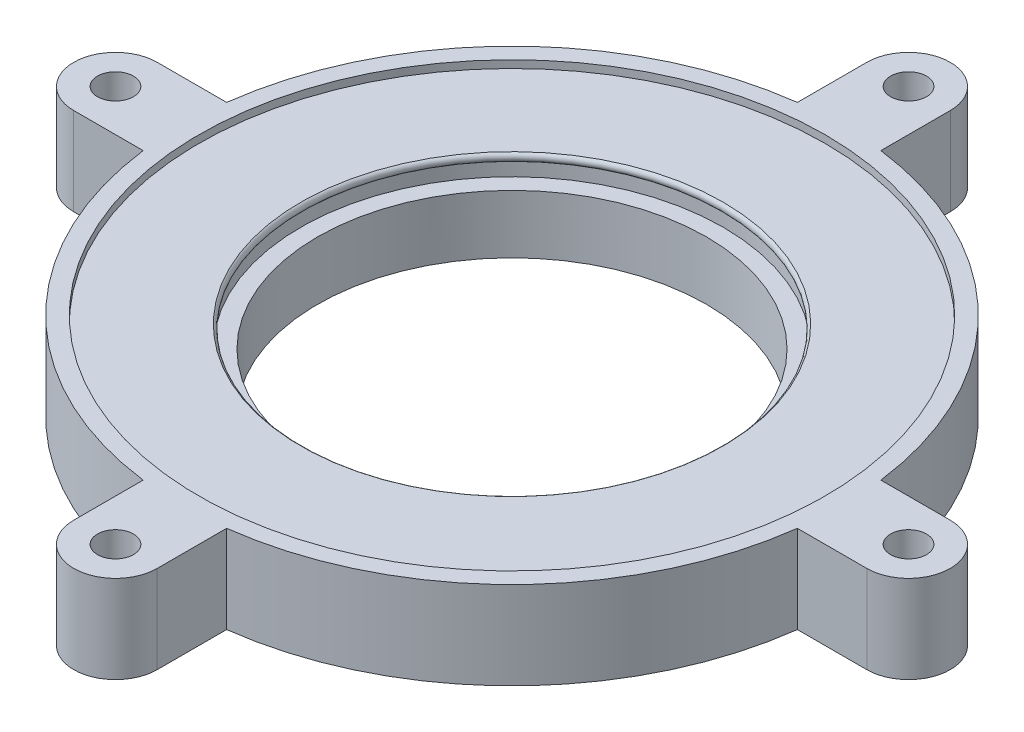
from build123d import *

# Parameters (mm, degrees)
SKETCH2_R           = 2.15
BOSS_EXTRUDE1_DEPTH = 10.507214
CUT_EXTRUDE2_DEPTH  = 7
SKETCH4_R           = 2.15
CUT_EXTRUDE3_DEPTH  = 7
BOSS_EXTRUDE2_START = -7
SKETCH5_R           = 24.3
SKETCH5_R_2         = 23.3
BOSS_EXTRUDE2_DEPTH = 7
SKETCH6_R           = 23.3
CUT_EXTRUDE4_DEPTH  = 75.575465


with BuildPart() as part:
    # Sketch1 → Revolve1 (revolve)
    with BuildSketch(Plane(origin=(0, 0, 0), x_dir=(0, 0, -1), z_dir=(1, 0, 0)), mode=Mode.PRIVATE) as revolve1_sk:
        with BuildLine():
            Line((-37.5, -1.048229), (-37.5, -1.955443))
            Line((-37.5, -1.955443), (-25.3, -1.955443))
            ThreePointArc((-25.3, -1.955443), (-25, -2.455443), (-25.3, -2.955443))
            Line((-25.3, -2.955443), (-25.3, -4.555443))
            Line((-25.3, -4.555443), (-8, -4.555443))
            Line((-8, -4.555443), (-8, -11.555443))
            Line((-8, -11.555443), (-39.5, -11.555443))
            Line((-39.5, -11.555443), (-39.5, -1.048229))
            Line((-39.5, -1.048229), (-37.5, -1.048229))
        make_face()
    revolve(revolve1_sk.sketch.rotate(Axis((0, -1000, 0), (0, 1, 0)), 180), axis=Axis((0, -1000, 0), (0, 1, 0)))

    # Sketch2 → Boss-Extrude1 (add)
    # profile 1 of 4: a face of its own
    with BuildSketch(Plane.XZ.offset(11.555443)):
        with BuildLine():
            Line((-5, 47.5), (-5, 39.182266))
            Line((-5, 39.182266), (5, 39.182266))
            Line((5, 39.182266), (5, 47.5))
            ThreePointArc((5, 47.5), (0, 52.5), (-5, 47.5))
        make_face()
        with Locations(Location((0, 47.5, 0), (0, 0, 270))):
            Circle(SKETCH2_R, mode=Mode.SUBTRACT)
    # profile 2 of 4: a face of its own
    with BuildSketch(Plane.XZ.offset(11.555443)):
        with BuildLine():
            Line((47.5, -5), (39.182266, -5))
            Line((39.182266, -5), (39.182266, 5))
            Line((39.182266, 5), (47.5, 5))
            ThreePointArc((47.5, 5), (52.5, 0), (47.5, -5))
        make_face()
        with Locations(Location((47.5, 0, 0), (0, 0, 270))):
            Circle(SKETCH2_R, mode=Mode.SUBTRACT)
    # profile 3 of 4: a face of its own
    with BuildSketch(Plane.XZ.offset(11.555443)):
        with BuildLine():
            Line((-5, -47.5), (-5, -39.182266))
            Line((-5, -39.182266), (5, -39.182266))
            Line((5, -39.182266), (5, -47.5))
            ThreePointArc((5, -47.5), (0, -52.5), (-5, -47.5))
        make_face()
        with Locations(Location((0, -47.5, 0), (0, 0, 270))):
            Circle(SKETCH2_R, mode=Mode.SUBTRACT)
    # profile 4 of 4: a face of its own
    with BuildSketch(Plane.XZ.offset(11.555443)):
        with BuildLine():
            Line((-47.5, 5), (-39.182266, 5))
            Line((-39.182266, 5), (-39.182266, -5))
            Line((-39.182266, -5), (-47.5, -5))
            ThreePointArc((-47.5, -5), (-52.5, 0), (-47.5, 5))
        make_face()
        with Locations(Location((-47.5, 0, 0), (0, 0, 270))):
            Circle(SKETCH2_R, mode=Mode.SUBTRACT)
    extrude(amount=-BOSS_EXTRUDE1_DEPTH)

    # Sketch3 → Cut-Extrude2 (cut)
    with BuildSketch(Plane(origin=(0, -4.555443, 0), x_dir=(1, 0, 0), z_dir=(0, 1, 0))):
        with BuildLine():
            Line((21.938323, -2), (12.369317, -2))
            ThreePointArc((12.369317, -2), (11.19262, -2.382785), (10.466345, -3.384615))
            ThreePointArc((10.466345, -3.384615), (7.778175, -7.778175), (3.384615, -10.466345))
            ThreePointArc((3.384615, -10.466345), (2.382785, -11.19262), (2, -12.369317))
            Line((2, -12.369317), (2, -21.938323))
            ThreePointArc((2, -21.938323), (2.718885, -23.474143), (4.358744, -23.905885))
            ThreePointArc((4.358744, -23.905885), (17.182695, -17.182695), (23.905885, -4.358744))
            ThreePointArc((23.905885, -4.358744), (23.474143, -2.718885), (21.938323, -2))
        make_face()
        with BuildLine():
            Line((-2, -21.938323), (-2, -12.369317))
            ThreePointArc((-2, -12.369317), (-2.382785, -11.19262), (-3.384615, -10.466345))
            ThreePointArc((-3.384615, -10.466345), (-7.778175, -7.778175), (-10.466345, -3.384615))
            ThreePointArc((-10.466345, -3.384615), (-11.19262, -2.382785), (-12.369317, -2))
            Line((-12.369317, -2), (-21.938323, -2))
            ThreePointArc((-21.938323, -2), (-23.474143, -2.718885), (-23.905885, -4.358744))
            ThreePointArc((-23.905885, -4.358744), (-17.182695, -17.182695), (-4.358744, -23.905885))
            ThreePointArc((-4.358744, -23.905885), (-2.718885, -23.474143), (-2, -21.938323))
        make_face()
        with BuildLine():
            Line((-21.938323, 2), (-12.369317, 2))
            ThreePointArc((-12.369317, 2), (-11.19262, 2.382785), (-10.466345, 3.384615))
            ThreePointArc((-10.466345, 3.384615), (-7.778175, 7.778175), (-3.384615, 10.466345))
            ThreePointArc((-3.384615, 10.466345), (-2.382785, 11.19262), (-2, 12.369317))
            Line((-2, 12.369317), (-2, 21.938323))
            ThreePointArc((-2, 21.938323), (-2.718885, 23.474143), (-4.358744, 23.905885))
            ThreePointArc((-4.358744, 23.905885), (-17.182695, 17.182695), (-23.905885, 4.358744))
            ThreePointArc((-23.905885, 4.358744), (-23.474143, 2.718885), (-21.938323, 2))
        make_face()
        with BuildLine():
            Line((2, 21.938323), (2, 12.369317))
            ThreePointArc((2, 12.369317), (2.382785, 11.19262), (3.384615, 10.466345))
            ThreePointArc((3.384615, 10.466345), (7.778175, 7.778175), (10.466345, 3.384615))
            ThreePointArc((10.466345, 3.384615), (11.19262, 2.382785), (12.369317, 2))
            Line((12.369317, 2), (21.938323, 2))
            ThreePointArc((21.938323, 2), (23.474143, 2.718885), (23.905885, 4.358744))
            ThreePointArc((23.905885, 4.358744), (17.182695, 17.182695), (4.358744, 23.905885))
            ThreePointArc((4.358744, 23.905885), (2.718885, 23.474143), (2, 21.938323))
        make_face()
    extrude(amount=-CUT_EXTRUDE2_DEPTH, mode=Mode.SUBTRACT)

    # Sketch4 → Cut-Extrude3 (cut)
    with BuildSketch(Plane(origin=(0, -11.555443, 0), x_dir=(-1, 0, 0), z_dir=(0, -1, 0))):
        with Locations(Location((30, 0, 0), (0, 0, 90))):
            Circle(SKETCH4_R)
        with Locations(Location((0, -30, 0), (0, 0, 90))):
            Circle(SKETCH4_R)
        with Locations(Location((-30, 0, 0), (0, 0, 90))):
            Circle(SKETCH4_R)
        with Locations(Location((0, 30, 0), (0, 0, 90))):
            Circle(SKETCH4_R)
    extrude(amount=-CUT_EXTRUDE3_DEPTH, mode=Mode.SUBTRACT)

    # Sketch5 → Boss-Extrude2 (add)
    with BuildSketch(Plane.XZ.offset(11.555443).offset(BOSS_EXTRUDE2_START)):
        Circle(SKETCH5_R)
        Circle(SKETCH5_R_2, mode=Mode.SUBTRACT)
    extrude(amount=BOSS_EXTRUDE2_DEPTH)

    # Sketch6 → Cut-Extrude4 (cut, through all)
    with BuildSketch(Plane(origin=(0, -4.555443, 0), x_dir=(1, 0, 0), z_dir=(0, 1, 0))):
        with Locations(Location((0, 0, 0), (0, 0, 90))):
            Circle(SKETCH6_R)
    extrude(amount=-CUT_EXTRUDE4_DEPTH, mode=Mode.SUBTRACT)


solid = part.part
